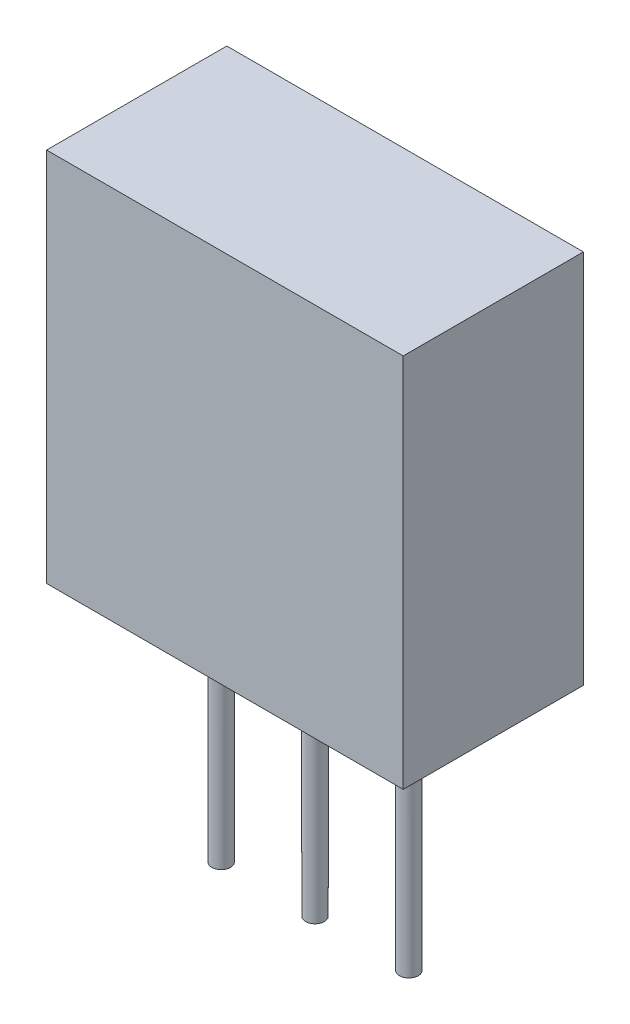
from build123d import *

# Parameters (mm, degrees)
SKETCH1_W           = 9.5
SKETCH1_H           = 10
BOSS_EXTRUDE1_DEPTH = 4.8
SKETCH2_R           = 0.25
BOSS_EXTRUDE2_DEPTH = 6.5


with BuildPart() as part:
    # Sketch1 → Boss-Extrude1 (new body)
    with BuildSketch(Plane.XY):
        with Locations((4.75, 5)):
            Rectangle(SKETCH1_W, SKETCH1_H)
    extrude(amount=BOSS_EXTRUDE1_DEPTH)

    # Sketch2 → Boss-Extrude2 (add)
    with BuildSketch(Plane(origin=(0, 0, 0), x_dir=(-1, 0, 0), z_dir=(0, -1, 0))):
        with Locations(Location((-4.75, -2.4, 0), (0, 0, 270))):
            Circle(SKETCH2_R)
        with Locations(Location((-2.25, -2.4, 0), (0, 0, 270))):
            Circle(SKETCH2_R)
        with Locations(Location((-7.25, -2.4, 0), (0, 0, 270))):
            Circle(SKETCH2_R)
    extrude(amount=BOSS_EXTRUDE2_DEPTH)


solid = part.part
